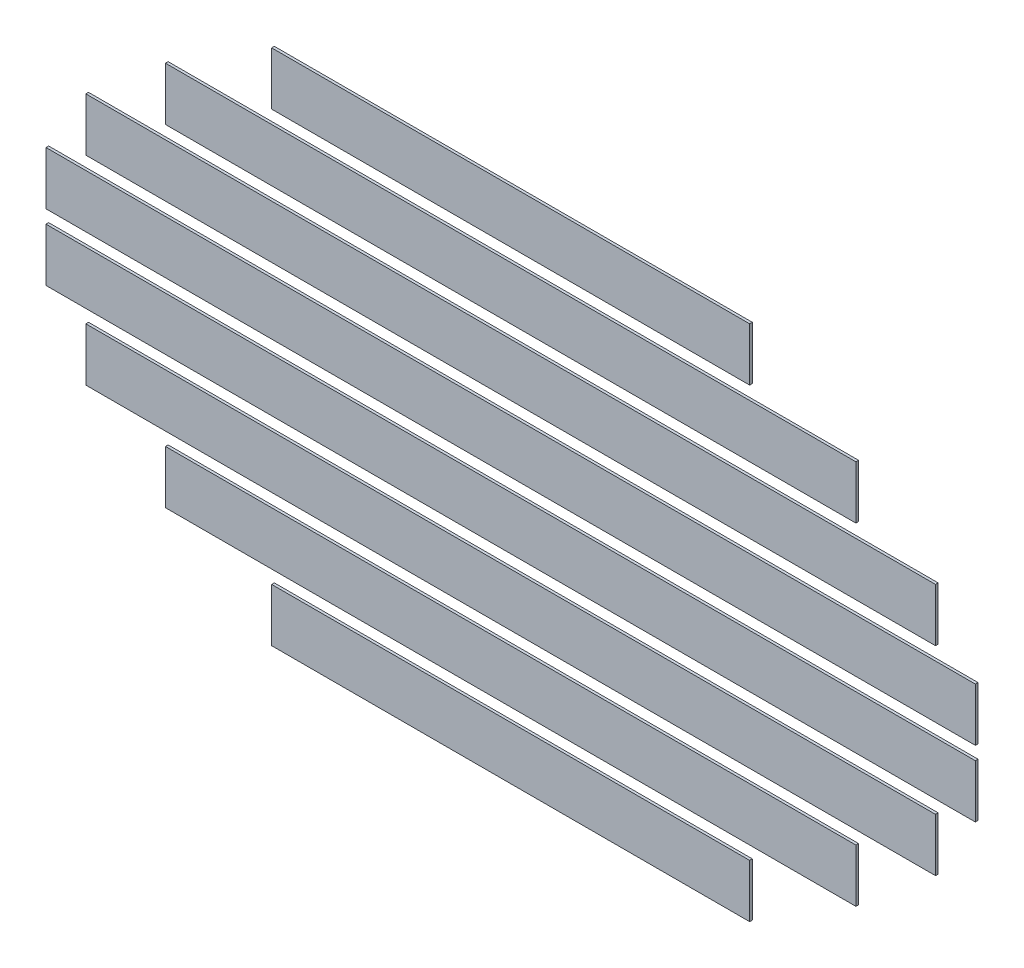
from build123d import *

# Parameters (mm, degrees)
ESQUISSE1_W          = 350
ESQUISSE1_H          = 20
BOSS_EXTRU_1_DEPTH   = 1
ESQUISSE1_W_2        = 320
BOSS_EXTRU_1_2_DEPTH = 1
ESQUISSE1_W_3        = 260
BOSS_EXTRU_1_3_DEPTH = 1
ESQUISSE1_W_4        = 180
BOSS_EXTRU_1_4_DEPTH = 1
BOSS_EXTRU_1_5_DEPTH = 1
BOSS_EXTRU_1_6_DEPTH = 1
BOSS_EXTRU_1_7_DEPTH = 1
BOSS_EXTRU_1_8_DEPTH = 1


with BuildPart() as part:
    # Esquisse1 → Boss.-Extru.1 (new body)
    with BuildSketch(Plane.XY):
        with Locations((-11.56678578, 13.394600175)):
            Rectangle(ESQUISSE1_W, ESQUISSE1_H)
    extrude(amount=BOSS_EXTRU_1_DEPTH)


with BuildPart() as body_2:
    # Esquisse1 → Boss.-Extru.1 2 (new body)
    with BuildSketch(Plane.XY):
        with Locations((-11.56678578, 38.394600175)):
            Rectangle(ESQUISSE1_W_2, ESQUISSE1_H)
    extrude(amount=BOSS_EXTRU_1_2_DEPTH)


with BuildPart() as body_3:
    # Esquisse1 → Boss.-Extru.1 3 (new body)
    with BuildSketch(Plane.XY):
        with Locations((-11.56678578, 63.394600175)):
            Rectangle(ESQUISSE1_W_3, ESQUISSE1_H)
    extrude(amount=BOSS_EXTRU_1_3_DEPTH)


with BuildPart() as body_4:
    # Esquisse1 → Boss.-Extru.1 4 (new body)
    with BuildSketch(Plane.XY):
        with Locations((-11.56678578, 88.394600175)):
            Rectangle(ESQUISSE1_W_4, ESQUISSE1_H)
    extrude(amount=BOSS_EXTRU_1_4_DEPTH)


with BuildPart() as body_5:
    # Esquisse1 → Boss.-Extru.1 5 (new body)
    with BuildSketch(Plane.XY):
        with Locations((-11.56678578, -11.605399825)):
            Rectangle(ESQUISSE1_W, ESQUISSE1_H)
    extrude(amount=BOSS_EXTRU_1_5_DEPTH)


with BuildPart() as body_6:
    # Esquisse1 → Boss.-Extru.1 6 (new body)
    with BuildSketch(Plane.XY):
        with Locations((-11.56678578, -36.605399825)):
            Rectangle(ESQUISSE1_W_2, ESQUISSE1_H)
    extrude(amount=BOSS_EXTRU_1_6_DEPTH)


with BuildPart() as body_7:
    # Esquisse1 → Boss.-Extru.1 7 (new body)
    with BuildSketch(Plane.XY):
        with Locations((-11.56678578, -61.605399825)):
            Rectangle(ESQUISSE1_W_3, ESQUISSE1_H)
    extrude(amount=BOSS_EXTRU_1_7_DEPTH)


with BuildPart() as body_8:
    # Esquisse1 → Boss.-Extru.1 8 (new body)
    with BuildSketch(Plane.XY):
        with Locations((-11.56678578, -86.605399825)):
            Rectangle(ESQUISSE1_W_4, ESQUISSE1_H)
    extrude(amount=BOSS_EXTRU_1_8_DEPTH)


solid = Compound([part.part, body_2.part, body_3.part, body_4.part, body_5.part, body_6.part, body_7.part, body_8.part])
